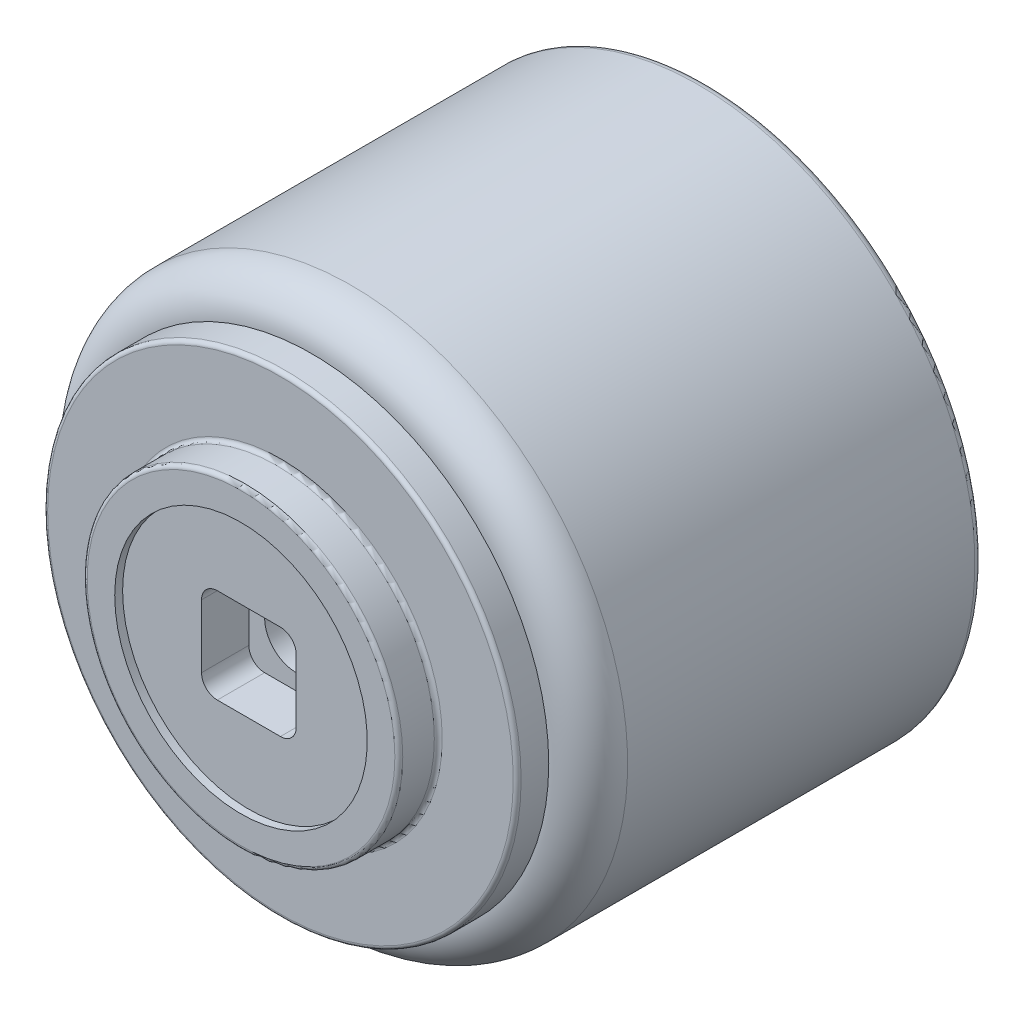
from build123d import *

# Parameters (mm, degrees)
SKETCH2_R                    = 20
BOSS_EXTRUDE1_DEPTH          = 5
SKETCH3_W                    = 12
SKETCH3_H                    = 12
CUT_EXTRUDE1_DEPTH           = 7
M45_CLEARANCE_HOLE1_D        = 50
M45_CLEARANCE_HOLE1_DEPTH    = 3
SKETCH6_W                    = 12.5
SKETCH6_H                    = 2
SKETCH7_W                    = 16
SKETCH7_H                    = 1
F_8_0_8_DIAMETER_HOLE1_D     = 8
F_8_0_8_DIAMETER_HOLE1_DEPTH = 52
FILLET1_R                    = 0.5
FILLET2_R                    = 1
FILLET3_R                    = 2


with BuildPart() as part:
    # Sketch1 → Revolve1 (revolve)
    with BuildSketch(Plane.XZ, mode=Mode.PRIVATE) as revolve1_sk:
        with BuildLine():
            Line((30, 54), (0, 54))
            Line((0, 54), (0, 0))
            Line((0, 0), (35, 0))
            Line((35, 0), (35, 45))
            ThreePointArc((35, 45), (33.535533906, 48.535533906), (30, 50))
            Line((30, 50), (30, 54))
        make_face()
    revolve(revolve1_sk.sketch.rotate(Axis((0, 0, 54), (0, 0, -1)), 180), axis=Axis((0, 0, 54), (0, 0, -1)))

    # Sketch2 → Boss-Extrude1 (add)
    with BuildSketch(Plane.XY.offset(54)):
        Circle(SKETCH2_R)
    extrude(amount=BOSS_EXTRUDE1_DEPTH)

    # Sketch3 → Cut-Extrude1 (cut)
    with BuildSketch(Plane.XY.offset(59)):
        Rectangle(SKETCH3_W, SKETCH3_H)
    extrude(amount=-CUT_EXTRUDE1_DEPTH, mode=Mode.SUBTRACT)

    # M45 Clearance Hole1
    with Locations(Plane(origin=(0, 0, 0), x_dir=(-1, 0, 0), z_dir=(0, 0, -1))):
        with Locations((0, 0)):
            Hole(M45_CLEARANCE_HOLE1_D / 2, depth=M45_CLEARANCE_HOLE1_DEPTH)

    # Sketch6 → Revolve2 (revolve)
    with BuildSketch(Plane(origin=(0, 0, 0), x_dir=(1, 0, 0), z_dir=(0, 1, 0)), mode=Mode.PRIVATE) as revolve2_sk:
        with Locations((6.25, -2)):
            Rectangle(SKETCH6_W, SKETCH6_H)
    revolve(revolve2_sk.sketch.rotate(Axis((0, 0, 1), (0, 0, 1)), 180), axis=Axis((0, 0, 1), (0, 0, 1)))

    # Sketch7 → Cut-Revolve1 (revolve, cut)
    with BuildSketch(Plane(origin=(0, 0, 0), x_dir=(1, 0, 0), z_dir=(0, 1, 0))):
        with Locations((-8, -58.5)):
            Rectangle(SKETCH7_W, SKETCH7_H)
    revolve(axis=Axis((0, 0, 59), (0, 0, -1)), mode=Mode.SUBTRACT)

    # Ø8.0 (8) Diameter Hole1
    with Locations(Plane.XY.offset(52)):
        with Locations((0, 0)):
            Hole(F_8_0_8_DIAMETER_HOLE1_D / 2, depth=F_8_0_8_DIAMETER_HOLE1_DEPTH)

    # Fillet1
    fillet1_edges = [part.edges().sort_by_distance(p)[0] for p in [
        (-20, 0, 54),
        (-20, 0, 59),
        (-25, 0, 0),
        (-25, 0, 3),
        (12.5, 0, 1),
        (12.5, 0, 3),
        (30, 0, 54),
    ]]
    fillet(fillet1_edges, radius=FILLET1_R)

    # Fillet2
    fillet2_edges = [part.edges().sort_by_distance(p)[0] for p in [
        (35, 0, 0),
    ]]
    fillet(fillet2_edges, radius=FILLET2_R)

    # Fillet3
    fillet3_edges = [part.edges().sort_by_distance(p)[0] for p in [
        (-6, 6, 55),
        (6, 6, 55),
        (6, -6, 55),
        (-6, -6, 55),
    ]]
    fillet(fillet3_edges, radius=FILLET3_R)


solid = part.part
